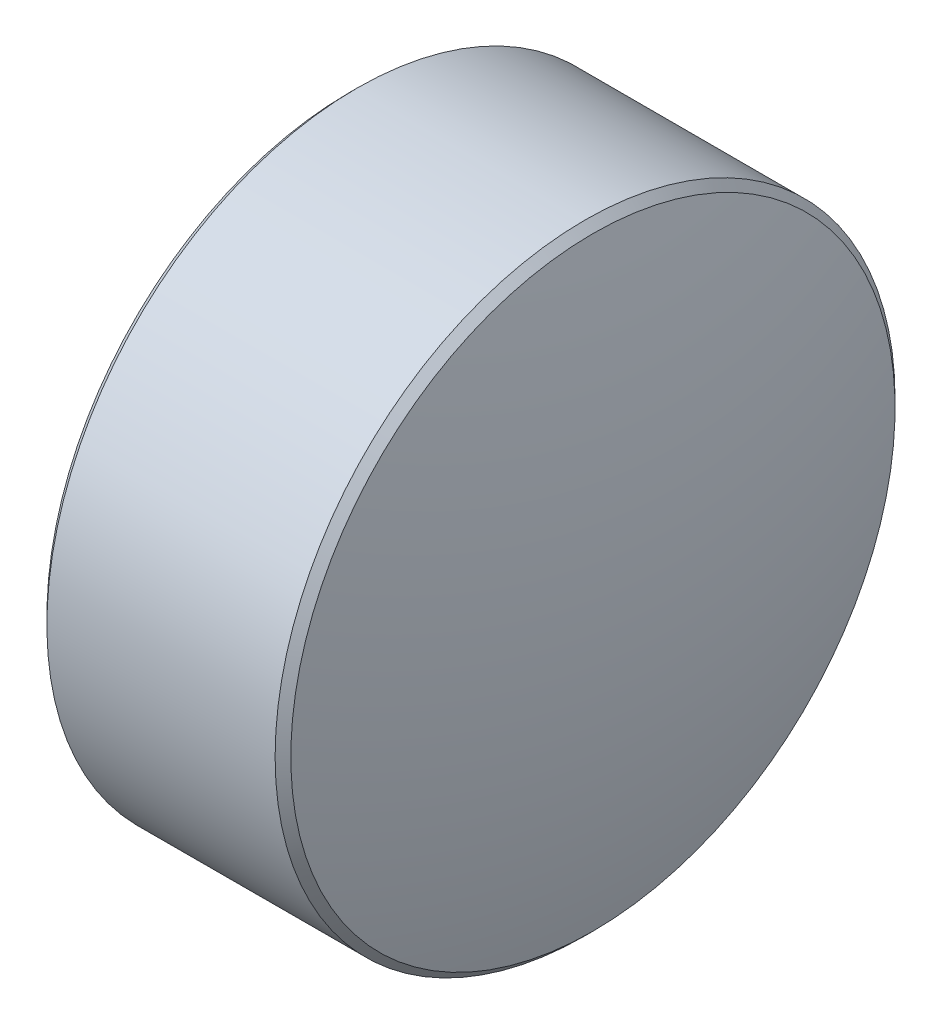
from build123d import *

# Parameters (mm, degrees)
CHAMFER2_SIZE         = 0.2
CHAMFER2_SIZE2        = 0.291356519
CHAMFER2_EDGE_2_SIZE  = 0.2
CHAMFER2_EDGE_2_SIZE2 = 0.291356519


with BuildPart() as part:
    # Sketch1 one side → Revolve1 (revolve)
    with BuildSketch(Plane.XY, mode=Mode.PRIVATE) as revolve1_sk:
        with BuildLine():
            Line((-4.25, -11), (4.25, -11))
            ThreePointArc((4.25, -11), (5.404796901, -5.553793215), (5.792230954, 0))
            Line((5.792230954, 0), (-5.792230954, 0))
            ThreePointArc((-5.792230954, 0), (-5.404796901, -5.553793215), (-4.25, -11))
        make_face()
    revolve(revolve1_sk.sketch.rotate(Axis((20.685395269, 0, 0), (-1, 0, 0)), 180), axis=Axis((20.685395269, 0, 0), (-1, 0, 0)))

    # Chamfer2
    chamfer2_edges = [part.edges().sort_by_distance(p)[0] for p in [
        (-4.25, -11, 0),
    ]]
    chamfer2_side = [part.faces().sort_by_distance(p)[0] for p in [
        (0, -11, 0),
    ]]
    chamfer(chamfer2_edges, length=CHAMFER2_SIZE, length2=CHAMFER2_SIZE2, reference=chamfer2_side[0])

    # Chamfer2 edge 2
    chamfer2_edge_2_edges = [part.edges().sort_by_distance(p)[0] for p in [
        (4.25, -11, 0),
    ]]
    chamfer2_edge_2_side = [part.faces().sort_by_distance(p)[0] for p in [
        (0, -11, 0),
    ]]
    chamfer(chamfer2_edge_2_edges, length=CHAMFER2_EDGE_2_SIZE, length2=CHAMFER2_EDGE_2_SIZE2, reference=chamfer2_edge_2_side[0])


solid = part.part
